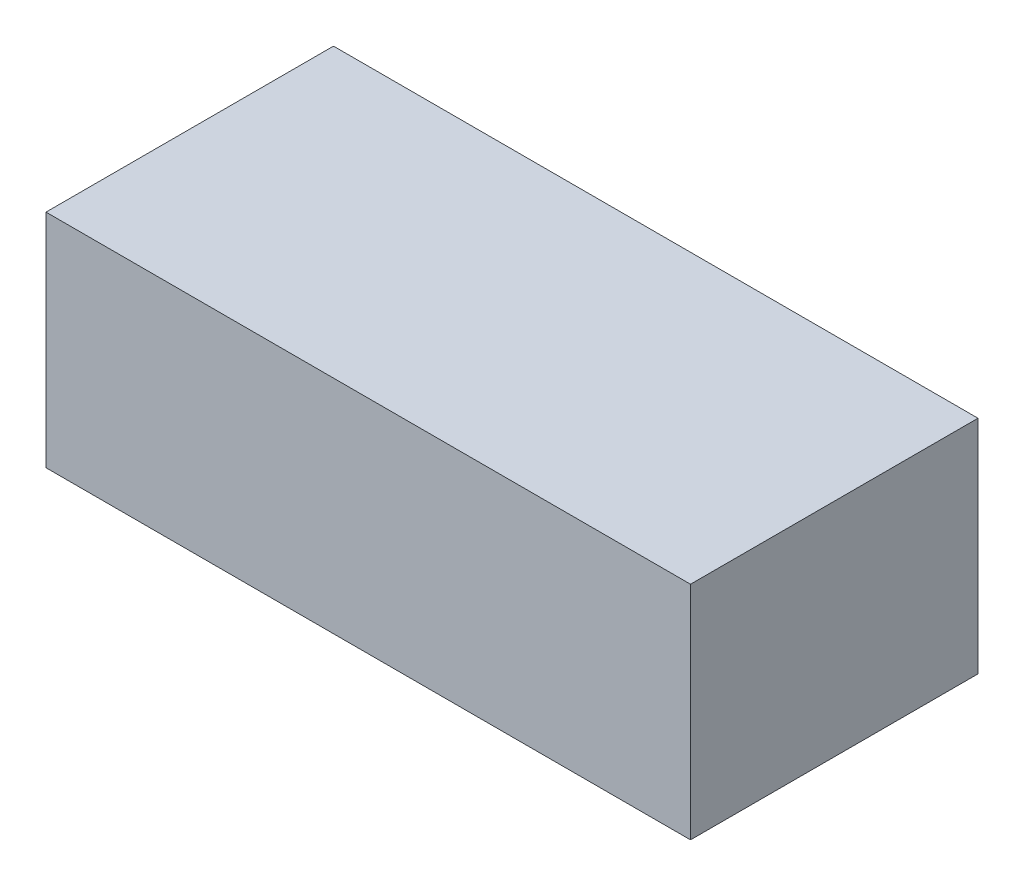
from build123d import *

# Parameters (mm, degrees)
SKETCH1_W           = 33.5
SKETCH1_H           = 25.8
BOSS_EXTRUDE1_DEPTH = 75.1


with BuildPart() as part:
    # Sketch1 → Boss-Extrude1 (new body)
    with BuildSketch(Plane(origin=(0, 0, 0), x_dir=(0, 0, -1), z_dir=(1, 0, 0))):
        Rectangle(SKETCH1_W, SKETCH1_H)
    extrude(amount=BOSS_EXTRUDE1_DEPTH)


solid = part.part
